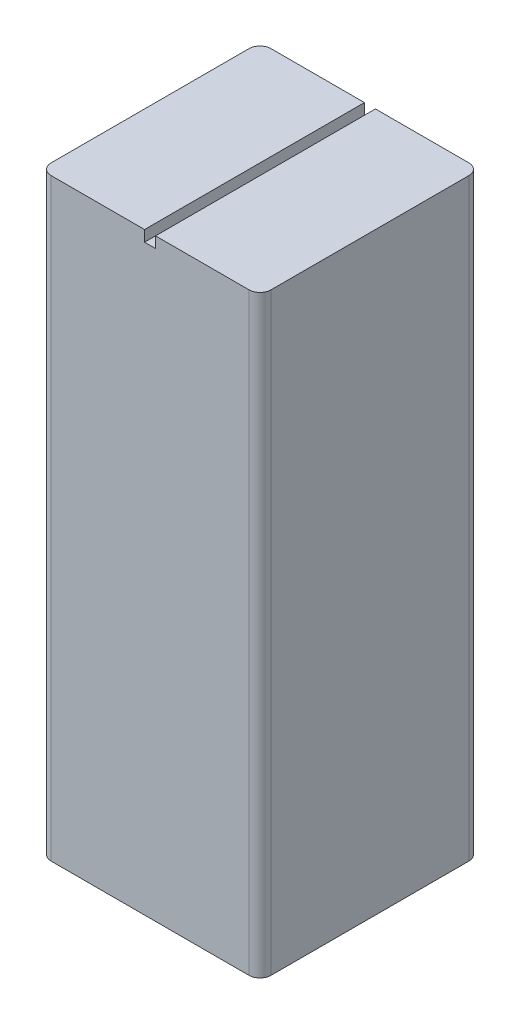
from build123d import *

# Parameters (mm, degrees)
SKETCH_1_W          = 20
SKETCH_1_H          = 20
EXTRUDE_1_DEPTH     = 54
FILLET_1_R          = 1
SKETCH_2_W          = 1
SKETCH_2_H          = 20
CUT_EXTRUDE_1_DEPTH = 1


with BuildPart() as part:
    # 草图1 → 凸台-拉伸1 (new body)
    with BuildSketch(Plane(origin=(0, 0, 0), x_dir=(1, 0, 0), z_dir=(0, 1, 0))):
        with Locations((10, 10)):
            Rectangle(SKETCH_1_W, SKETCH_1_H)
    extrude(amount=EXTRUDE_1_DEPTH)

    # 圆角1
    fillet_1_edges = [part.edges().sort_by_distance(p)[0] for p in [
        (0, 27, -20),
        (20, 27, -20),
        (20, 27, 0),
        (0, 27, 0),
    ]]
    fillet(fillet_1_edges, radius=FILLET_1_R)

    # 草图2 → 切除-拉伸1 (cut)
    with BuildSketch(Plane(origin=(0, 54, 0), x_dir=(1, 0, 0), z_dir=(0, 1, 0))):
        with Locations((10, 10)):
            Rectangle(SKETCH_2_W, SKETCH_2_H)
    extrude(amount=-CUT_EXTRUDE_1_DEPTH, mode=Mode.SUBTRACT)


solid = part.part
